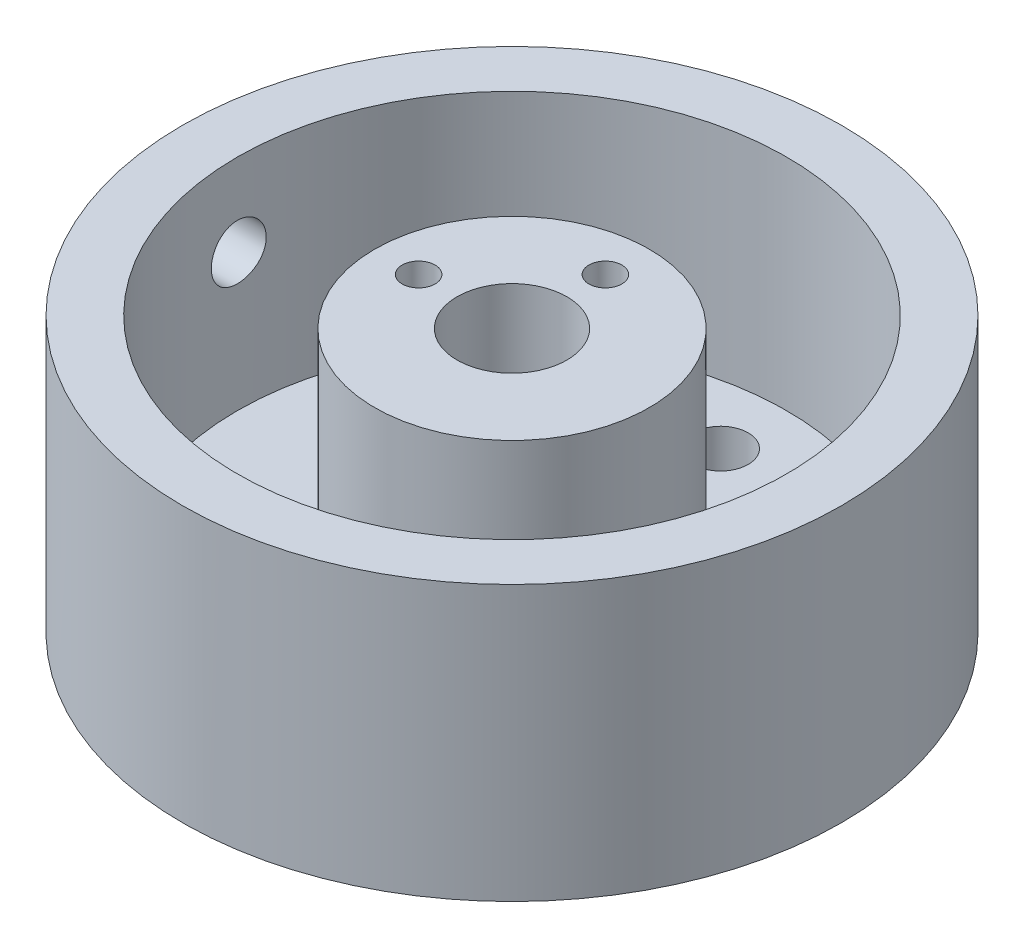
from build123d import *

# Parameters (mm, degrees)
SKETCH2_R                = 2.5
CUT_EXTRUDE1_DEPTH       = 10
SKETCH3_R                = 1.5
CUT_EXTRUDE2_DEPTH       = 8
SKETCH4_R                = 1.5
CUT_EXTRUDE3_DEPTH       = 4
SKETCH5_R                = 1.5
CUT_EXTRUDE4_DEPTH       = 4
CUT_EXTRUDE7_DEPTH       = 10
CUT_EXTRUDE7_DEPTH_BACK  = 10
SKETCH6_R                = 2.5
BOSS_EXTRUDE5_DEPTH      = 5
BOSS_EXTRUDE5_DEPTH_BACK = 5
SKETCH7_R                = 2.5


with BuildPart() as part:
    # Sketch1 → Revolve2 (revolve)
    with BuildSketch(Plane.XY):
        Polygon((5, 7.28), (5, 0), (30, 0), (30, 25), (25, 25), (25, 5), (12.5, 5), (12.5, 23.98), (5, 23.98), (5, 11.48), (7, 11.48), (7, 7.28), align=None)
    revolve(axis=Axis((0, 23.98, 0), (0, -1, 0)))

    # Sketch2 → Cut-Extrude1 (cut)
    with BuildSketch(Plane.XZ):
        with Locations((0, -19)):
            Circle(SKETCH2_R)
    extrude(amount=-CUT_EXTRUDE1_DEPTH, mode=Mode.SUBTRACT)

    # Sketch3 → Cut-Extrude2 (cut)
    with BuildSketch(Plane(origin=(0, 23.98, 0), x_dir=(1, 0, 0), z_dir=(0, 1, 0))):
        with Locations((-8.5, 0)):
            Circle(SKETCH3_R)
        with Locations((0, 8.5)):
            Circle(SKETCH3_R)
    extrude(amount=-CUT_EXTRUDE2_DEPTH, mode=Mode.SUBTRACT)

    # Sketch4 → Cut-Extrude3 (cut)
    with BuildSketch(Plane.XY.offset(-12.5)):
        with Locations((0, 17.5)):
            Circle(SKETCH4_R)
    extrude(amount=CUT_EXTRUDE3_DEPTH, mode=Mode.SUBTRACT)

    # Sketch5 → Cut-Extrude4 (cut)
    with BuildSketch(Plane(origin=(-12.5, 0, 0), x_dir=(0, 0, -1), z_dir=(1, 0, 0))):
        with Locations((0, 17.5)):
            Circle(SKETCH5_R)
    extrude(amount=CUT_EXTRUDE4_DEPTH, mode=Mode.SUBTRACT)

    # Sketch6 → Cut-Extrude7 (cut, two sides: drawn at the far end of the back side and taken through both)
    with BuildSketch(Plane(origin=(-30, 0, 0), x_dir=(0, 0, -1), z_dir=(1, 0, 0)).offset(-CUT_EXTRUDE7_DEPTH_BACK)):
        with Locations((0, 17.5)):
            Circle(SKETCH6_R)
    extrude(amount=CUT_EXTRUDE7_DEPTH + CUT_EXTRUDE7_DEPTH_BACK, mode=Mode.SUBTRACT)

    # Sketch7 → Boss-Extrude5 (add, two sides: drawn at the far end of the back side and taken through both)
    with BuildSketch(Plane.XY.offset(-BOSS_EXTRUDE5_DEPTH_BACK)):
        with BuildLine():
            Line((-32, 0), (-30, 0))
            Line((-30, 0), (-15, 0))
            Line((-15, 0), (-15, -9.5))
            ThreePointArc((-15, -9.5), (-15.878679656, -11.621320344), (-18, -12.5))
            Line((-18, -12.5), (-32, -12.5))
            ThreePointArc((-32, -12.5), (-34.121320344, -11.621320344), (-35, -9.5))
            Line((-35, -9.5), (-35, -3))
            ThreePointArc((-35, -3), (-34.121320344, -0.878679656), (-32, 0))
        make_face()
        with Locations((-25, -7.5)):
            Circle(SKETCH7_R, mode=Mode.SUBTRACT)
    extrude(amount=BOSS_EXTRUDE5_DEPTH + BOSS_EXTRUDE5_DEPTH_BACK)


solid = part.part
